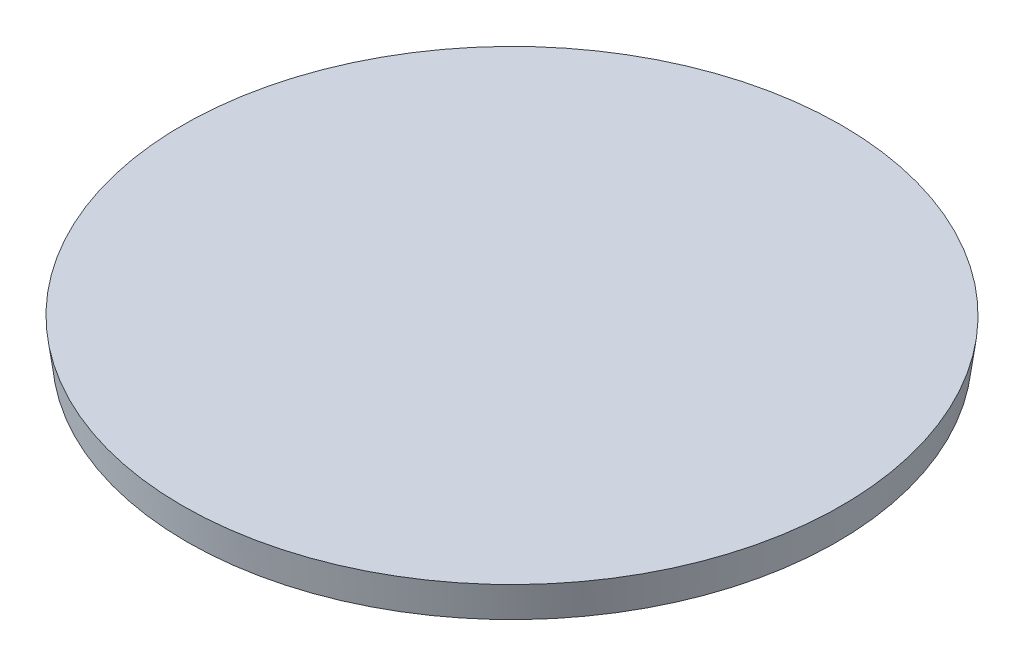
from build123d import *


with BuildPart() as part:
    # Sketch2 → Revolve1 (revolve)
    with BuildSketch(Plane.XY, mode=Mode.PRIVATE) as revolve1_sk:
        Polygon((0, 0), (14.7955, 0), (14.996138406, 1.524), (0, 1.524), align=None)
    revolve(revolve1_sk.sketch.rotate(Axis((0, 1.524, 0), (0, -1, 0)), 90), axis=Axis((0, 1.524, 0), (0, -1, 0)))


solid = part.part
